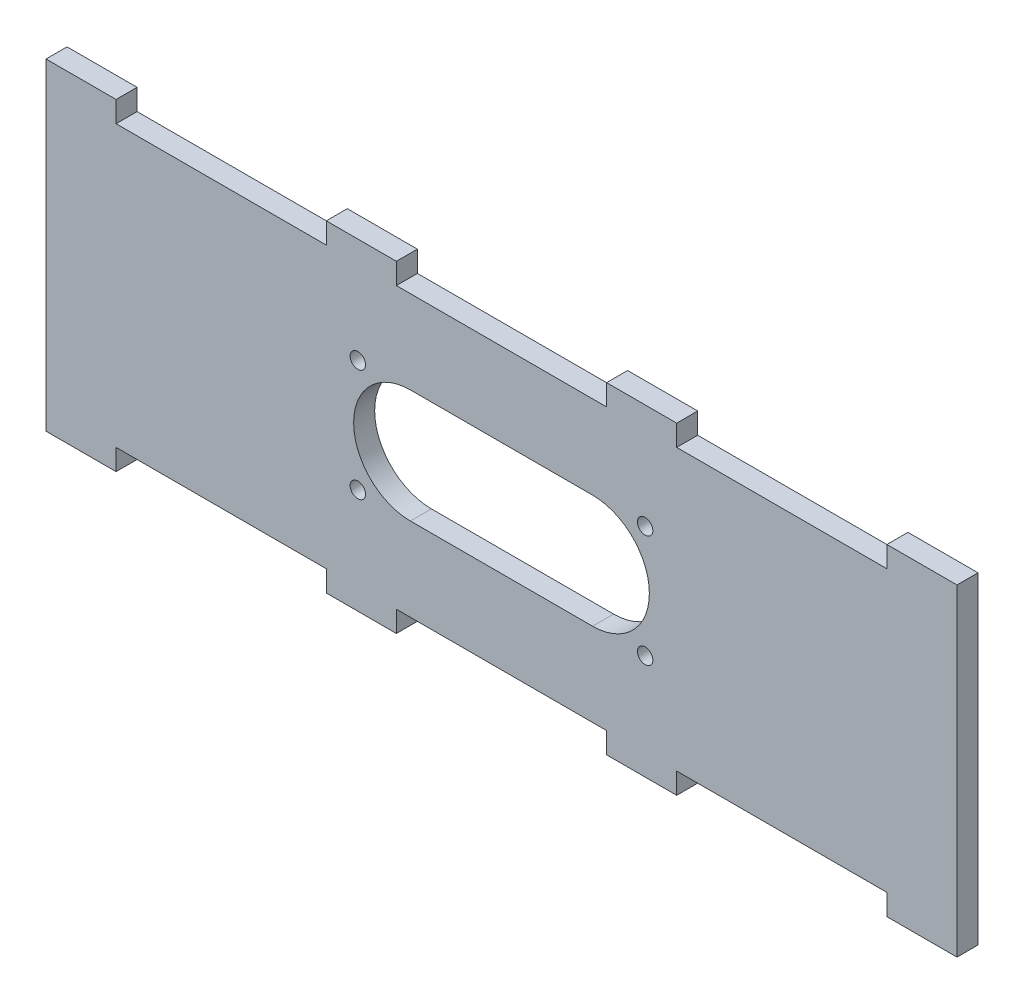
from build123d import *

# Parameters (mm, degrees)
SKETCH1_W           = 10
SKETCH1_H           = 3
BOSS_EXTRUDE1_DEPTH = 3
SKETCH4_R           = 1.1
CUT_EXTRUDE2_DEPTH  = 70.014491232


with BuildPart() as part:
    # Sketch1 → Boss-Extrude1 (new body)
    with BuildSketch(Plane.XY):
        Polygon((-65, 20), (-65, 0), (65, 0), (65, 20), (55, 20), (25, 20), (15, 20), (-15, 20), (-25, 20), (-55, 20), align=None)
        Polygon((65, 0), (-65, 0), (-65, -20), (-55, -20), (-25, -20), (-15, -20), (15, -20), (25, -20), (55, -20), (65, -20), align=None)
        with Locations((-60, 21.5)):
            Rectangle(SKETCH1_W, SKETCH1_H)
        with Locations((-20, 21.5)):
            Rectangle(SKETCH1_W, SKETCH1_H)
        with Locations((20, 21.5)):
            Rectangle(SKETCH1_W, SKETCH1_H)
        with Locations((60, 21.5)):
            Rectangle(SKETCH1_W, SKETCH1_H)
        with Locations((60, -21.5)):
            Rectangle(SKETCH1_W, SKETCH1_H)
        with Locations((20, -21.5)):
            Rectangle(SKETCH1_W, SKETCH1_H)
        with Locations((-20, -21.5)):
            Rectangle(SKETCH1_W, SKETCH1_H)
        with Locations((-60, -21.5)):
            Rectangle(SKETCH1_W, SKETCH1_H)
    extrude(amount=BOSS_EXTRUDE1_DEPTH)

    # Sketch4 → Cut-Extrude2 (cut, through all)
    with BuildSketch(Plane.XY.offset(3)):
        with Locations((-20.5, 8)):
            Circle(SKETCH4_R)
        with Locations((-20.5, -8)):
            Circle(SKETCH4_R)
        with Locations((20.5, 8)):
            Circle(SKETCH4_R)
        with Locations((20.5, -8)):
            Circle(SKETCH4_R)
        with BuildLine():
            Line((-13, 8.1), (13, 8.1))
            ThreePointArc((13, 8.1), (21.1, 0), (13, -8.1))
            Line((13, -8.1), (-13, -8.1))
            ThreePointArc((-13, -8.1), (-21.1, 0), (-13, 8.1))
        make_face()
    extrude(amount=-CUT_EXTRUDE2_DEPTH, mode=Mode.SUBTRACT)


solid = part.part
